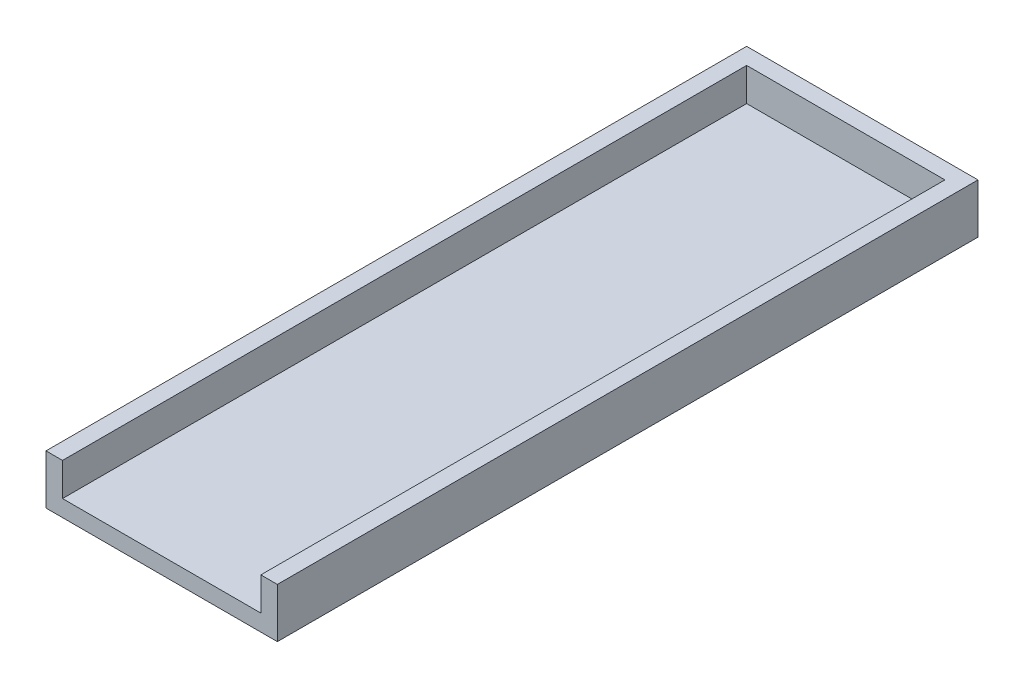
from build123d import *

# Parameters (mm, degrees)
SKETCH1_W           = 355.6
SKETCH1_H           = 1076.96
BOSS_EXTRUDE1_DEPTH = 76.2
SKETCH2_W           = 304.8
SKETCH2_H           = 1051.56
CUT_EXTRUDE1_DEPTH  = 50.8


with BuildPart() as part:
    # Sketch1 → Boss-Extrude1 (new body)
    with BuildSketch(Plane(origin=(0, 0, 0), x_dir=(1, 0, 0), z_dir=(0, 1, 0))):
        Rectangle(SKETCH1_W, SKETCH1_H)
    extrude(amount=BOSS_EXTRUDE1_DEPTH)

    # Sketch2 → Cut-Extrude1 (cut)
    with BuildSketch(Plane(origin=(0, 76.2, 0), x_dir=(1, 0, 0), z_dir=(0, 1, 0))):
        with Locations((0, -12.7)):
            Rectangle(SKETCH2_W, SKETCH2_H)
    extrude(amount=-CUT_EXTRUDE1_DEPTH, mode=Mode.SUBTRACT)


solid = part.part
